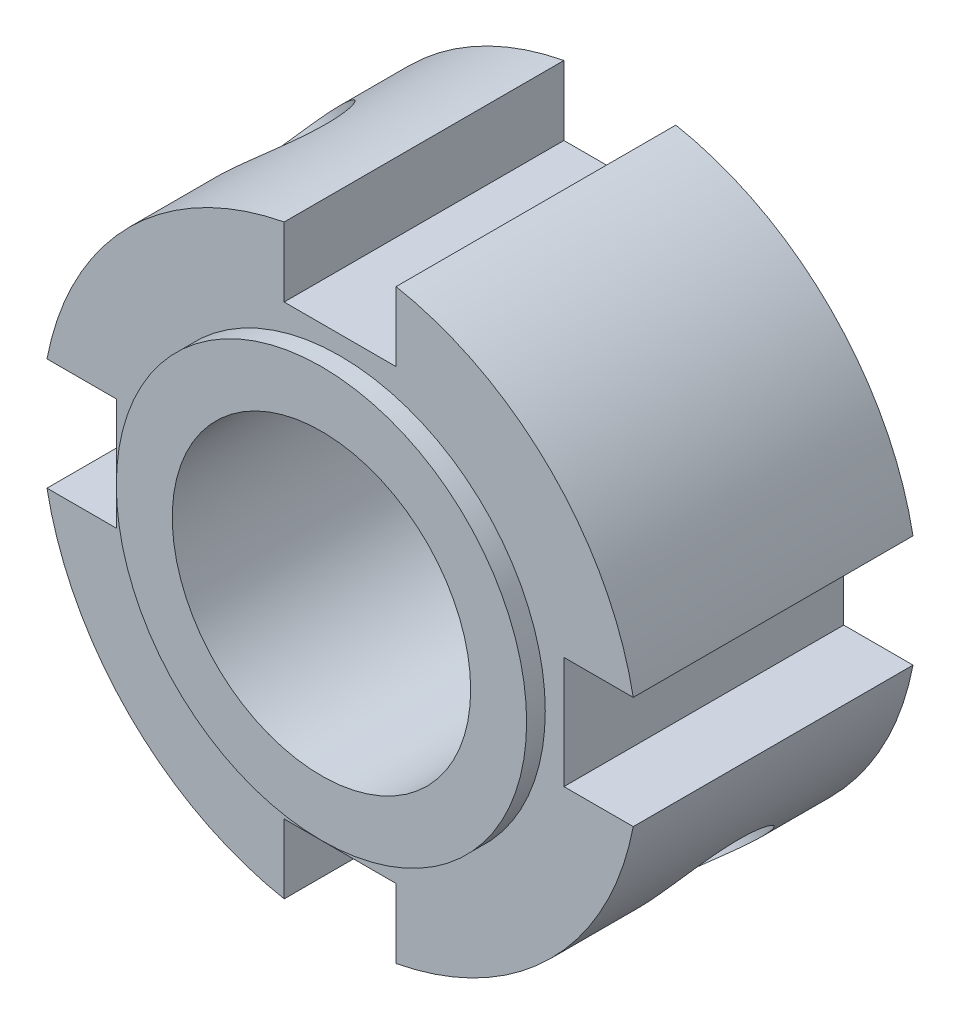
from build123d import *

# Parameters (mm, degrees)
EXTRUDE_START          = -3.5
SKETCH_1_R             = 8
SKETCH_1_R_2           = 4
EXTRUDE_1_DEPTH        = 7.5
SKETCH_2_R             = 5.5
SKETCH_2_R_2           = 4
EXTRUDE_2_DEPTH        = 0.5
CUT_EXTRUDE_1_DEPTH    = 7.5
HOLE_WIZARD_M4_1_D     = 3.3
HOLE_WIZARD_M4_1_DEPTH = 17.5
HOLE_WIZARD_M4_1_TIP   = 0.991420021


with BuildPart() as part:
    # 草图1 → 凸台-拉伸1 (new body)
    with BuildSketch(Plane.XY.offset(EXTRUDE_START)):
        Circle(SKETCH_1_R)
        Circle(SKETCH_1_R_2, mode=Mode.SUBTRACT)
    extrude(amount=EXTRUDE_1_DEPTH)

    # 草图2 → 凸台-拉伸2 (add)
    with BuildSketch(Plane.XY.offset(4)):
        Circle(SKETCH_2_R)
        Circle(SKETCH_2_R_2, mode=Mode.SUBTRACT)
    extrude(amount=EXTRUDE_2_DEPTH)

    # 草图3 → 切除-拉伸1 (cut)
    with BuildSketch(Plane(origin=(0, 0, -3.5), x_dir=(-1, 0, 0), z_dir=(0, 0, -1))):
        with BuildLine():
            Line((-7.858116823, -1.5), (-6, -1.5))
            Line((-6, -1.5), (-6, 1.5))
            Line((-6, 1.5), (-7.858116823, 1.5))
            ThreePointArc((-7.858116823, 1.5), (-8, 0), (-7.858116823, -1.5))
        make_face()
        with BuildLine():
            Line((1.5, -7.858116823), (1.5, -6))
            Line((1.5, -6), (-1.5, -6))
            Line((-1.5, -6), (-1.5, -7.858116823))
            ThreePointArc((-1.5, -7.858116823), (0, -8), (1.5, -7.858116823))
        make_face()
        with BuildLine():
            Line((-1.5, 6), (1.5, 6))
            Line((1.5, 6), (1.5, 7.858116823))
            ThreePointArc((1.5, 7.858116823), (0, 8), (-1.5, 7.858116823))
            Line((-1.5, 7.858116823), (-1.5, 6))
        make_face()
        with BuildLine():
            Line((6, -1.5), (7.858116823, -1.5))
            ThreePointArc((7.858116823, -1.5), (8, 0), (7.858116823, 1.5))
            Line((7.858116823, 1.5), (6, 1.5))
            Line((6, 1.5), (6, -1.5))
        make_face()
    extrude(amount=-CUT_EXTRUDE_1_DEPTH, mode=Mode.SUBTRACT)

    # M4 螺纹孔1
    with Locations(Plane(origin=(5.656854249, -5.656854249, 0), x_dir=(0, 0, -1), z_dir=(0.7071067811865464, -0.7071067811865488, 0))):
        with Locations((0, 0)):
            Hole(HOLE_WIZARD_M4_1_D / 2, depth=HOLE_WIZARD_M4_1_DEPTH)
            with Locations((0, 0, -(HOLE_WIZARD_M4_1_DEPTH + HOLE_WIZARD_M4_1_TIP / 2))):  # 118° drill point
                Cone(0, HOLE_WIZARD_M4_1_D / 2, HOLE_WIZARD_M4_1_TIP, mode=Mode.SUBTRACT)


solid = part.part
